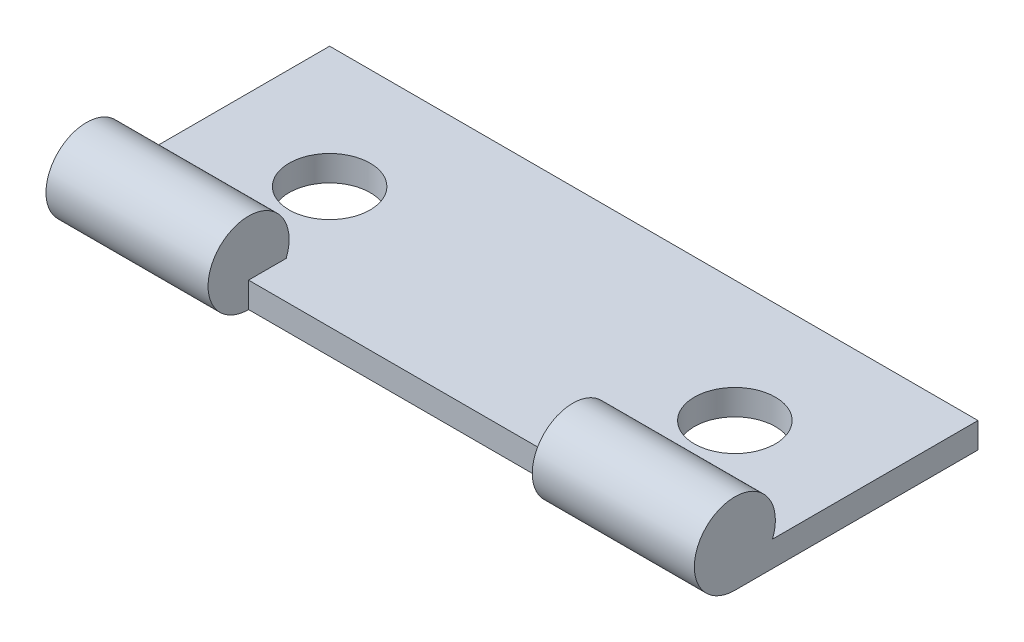
from build123d import *

# Parameters (mm, degrees)
SKETCH1_W           = 25.4
SKETCH1_H           = 9.525
SKETCH1_R           = 1.5875
BOSS_EXTRUDE1_DEPTH = 1
SKETCH2_R           = 1.5875
BOSS_EXTRUDE2_DEPTH = 6.35
LPATTERN1_COUNT     = 2
LPATTERN1_PITCH     = 19.05


with BuildPart() as part:
    # Sketch1 → Boss-Extrude1 (new body)
    with BuildSketch(Plane(origin=(0, 0, 0), x_dir=(1, 0, 0), z_dir=(0, 1, 0))):
        with Locations((12.7, 4.7625)):
            Rectangle(SKETCH1_W, SKETCH1_H)
        with Locations(Location((4.7625, 4.7625, 0), (0, 0, 270))):
            Circle(SKETCH1_R, mode=Mode.SUBTRACT)
        with Locations(Location((20.6375, 4.7625, 0), (0, 0, 90))):
            Circle(SKETCH1_R, mode=Mode.SUBTRACT)
    extrude(amount=BOSS_EXTRUDE1_DEPTH)

    # Sketch2 → Boss-Extrude2 (add)
    with BuildSketch(Plane.ZY):
        with Locations((0, 1.5875)):
            Circle(SKETCH2_R)
    boss_extrude2 = extrude(amount=-BOSS_EXTRUDE2_DEPTH)

    # LPattern1: Boss-Extrude2 ×2
    with Locations(*[(i * LPATTERN1_PITCH, 0, 0) for i in range(1, LPATTERN1_COUNT)]):
        add(boss_extrude2)


solid = part.part
